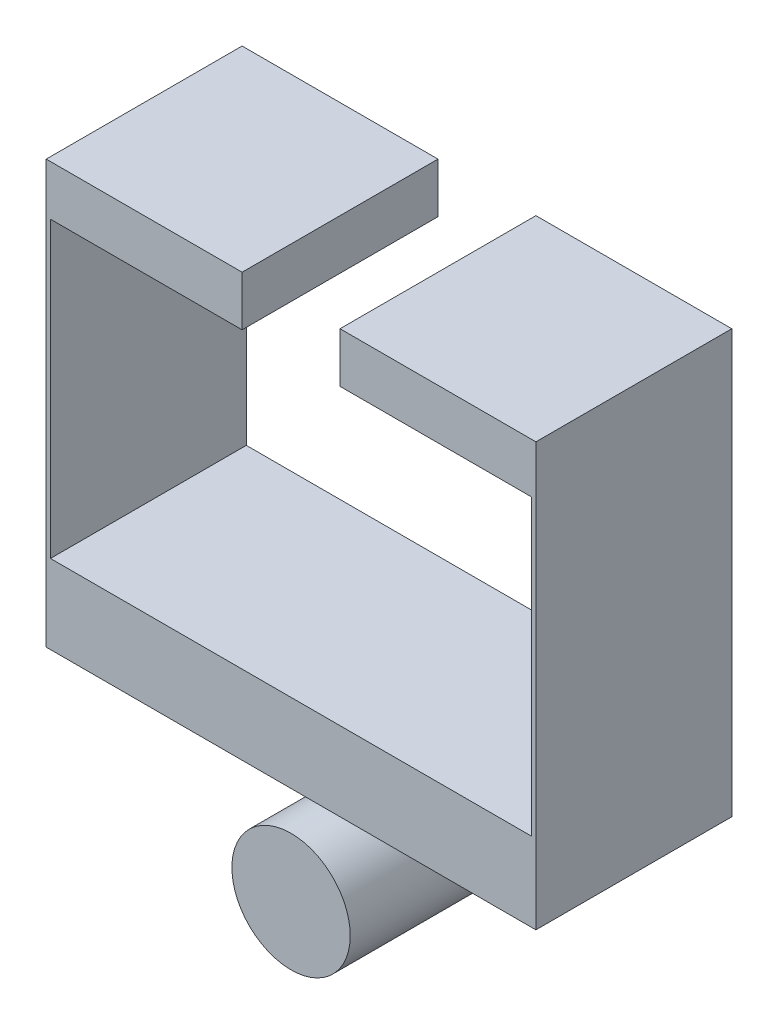
from build123d import *

# Parameters (mm, degrees)
SKETCH1_R           = 7.672873739
BOSS_EXTRUDE1_DEPTH = 25.4
SKETCH2_W           = 15.345747478
SKETCH2_H           = 12.7
BOSS_EXTRUDE2_DEPTH = 1.820422808
BOSS_EXTRUDE3_DEPTH = 25.4
SKETCH5_W           = 0.549916313
SKETCH5_H           = 38.1
BOSS_EXTRUDE4_DEPTH = 25.4
SKETCH6_W           = 25.4
SKETCH6_H           = 6.473300788
BOSS_EXTRUDE5_DEPTH = 25.4


with BuildPart() as part:
    # Sketch1 → Boss-Extrude1 (new body)
    with BuildSketch(Plane.XY):
        Circle(SKETCH1_R)
    extrude(amount=BOSS_EXTRUDE1_DEPTH)

    # Sketch2 → Boss-Extrude2 (add)
    with BuildSketch(Plane(origin=(0, 0, 0), x_dir=(-1, 0, 0), z_dir=(0, 0, -1))):
        with Locations((0, 6.35)):
            Rectangle(SKETCH2_W, SKETCH2_H)
    extrude(amount=-BOSS_EXTRUDE2_DEPTH)

    # Sketch4 → Boss-Extrude3 (add)
    with BuildSketch(Plane(origin=(0, 0, 0), x_dir=(-1, 0, 0), z_dir=(0, 0, -1))):
        Polygon((-31.75, 12.7), (-31.75, 22.935187234), (31.75, 22.935187234), (31.75, 12.7), (7.672873739, 12.7), (-7.672873739, 12.7), align=None)
    extrude(amount=-BOSS_EXTRUDE3_DEPTH)

    # Sketch5 → Boss-Extrude4 (add)
    with BuildSketch(Plane(origin=(0, 0, 0), x_dir=(-1, 0, 0), z_dir=(0, 0, -1))):
        with Locations((31.475041844, 41.985187234)):
            Rectangle(SKETCH5_W, SKETCH5_H)
        with Locations((-31.475041844, 41.985187234)):
            Rectangle(SKETCH5_W, SKETCH5_H)
    extrude(amount=-BOSS_EXTRUDE4_DEPTH)

    # Sketch6 → Boss-Extrude5 (add)
    with BuildSketch(Plane(origin=(0, 0, 0), x_dir=(-1, 0, 0), z_dir=(0, 0, -1))):
        with Locations((19.05, 64.271837628)):
            Rectangle(SKETCH6_W, SKETCH6_H)
        with Locations((-19.05, 64.271837628)):
            Rectangle(SKETCH6_W, SKETCH6_H)
    extrude(amount=-BOSS_EXTRUDE5_DEPTH)


solid = part.part
